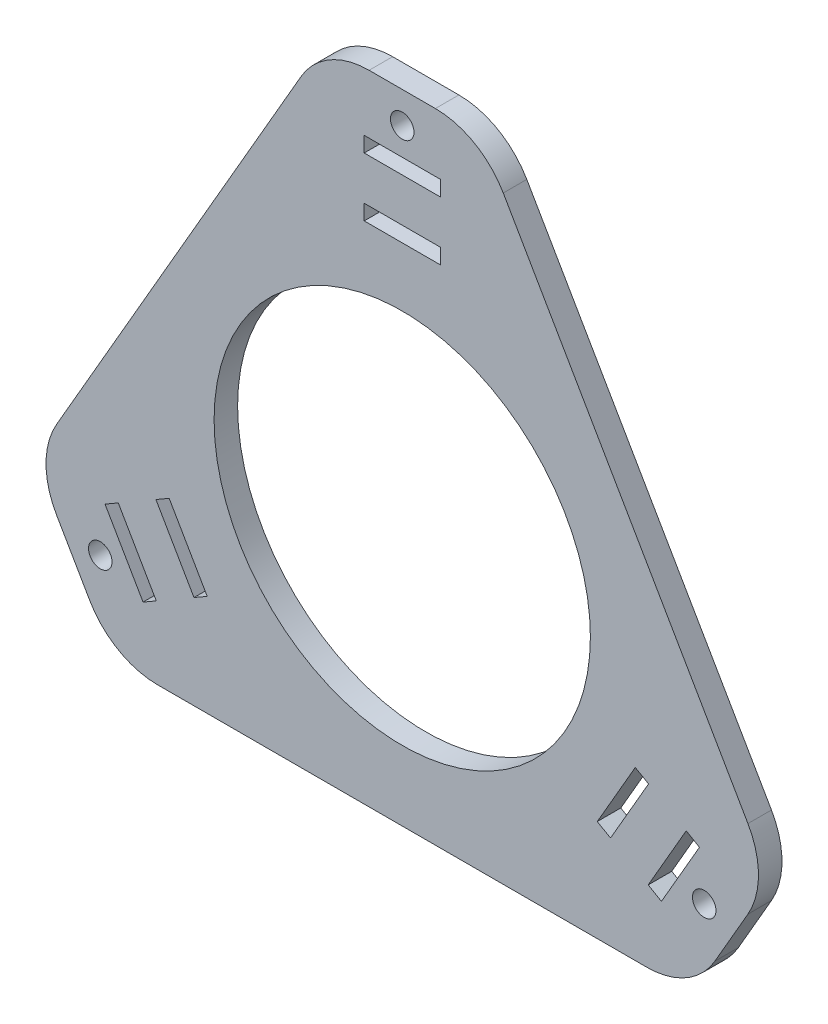
from build123d import *

# Parameters (mm, degrees)
SKETCH_1_R      = 1.5
SKETCH_1_R_2    = 24
SKETCH_1_W      = 9.7
SKETCH_1_H      = 1.95
EXTRUDE_4_DEPTH = 3


with BuildPart() as part:
    # Эскиз1 → Бобышка-Вытянуть4 (new body)
    with BuildSketch(Plane.XY):
        with BuildLine():
            Line((-31.207078757, -32.897754038), (31.207078757, -32.897754038))
            ThreePointArc((31.207078757, -32.897754038), (36.207078757, -31.558008076), (39.867332794, -27.897754038))
            Line((39.867332794, -27.897754038), (44.093830103, -20.577245962))
            ThreePointArc((44.093830103, -20.577245962), (45.433576065, -15.577245962), (44.093830103, -10.577245962))
            Line((44.093830103, -10.577245962), (12.886751346, 43.475))
            ThreePointArc((12.886751346, 43.475), (9.226497308, 47.135254038), (4.226497308, 48.475))
            Line((4.226497308, 48.475), (-4.226497308, 48.475))
            ThreePointArc((-4.226497308, 48.475), (-9.226497308, 47.135254038), (-12.886751346, 43.475))
            Line((-12.886751346, 43.475), (-44.093830103, -10.577245962))
            ThreePointArc((-44.093830103, -10.577245962), (-45.433576065, -15.577245962), (-44.093830103, -20.577245962))
            Line((-44.093830103, -20.577245962), (-39.867332794, -27.897754038))
            ThreePointArc((-39.867332794, -27.897754038), (-36.207078757, -31.558008076), (-31.207078757, -32.897754038))
        make_face()
        with Locations((-38.516479833, -22.2375)):
            Circle(SKETCH_1_R, mode=Mode.SUBTRACT)
        with Locations(Location((0, 44.475, 0), (0, 0, 180))):
            Circle(SKETCH_1_R, mode=Mode.SUBTRACT)
        with Locations((38.516479833, -22.2375)):
            Circle(SKETCH_1_R, mode=Mode.SUBTRACT)
        Circle(SKETCH_1_R_2, mode=Mode.SUBTRACT)
        Polygon((-33.06039092, -24.687723208), (-37.91039092, -16.287276792), (-36.221641383, -15.312276792), (-31.371641383, -23.712723208), align=None, mode=Mode.SUBTRACT)
        with Locations((0, 40)):
            Rectangle(SKETCH_1_W, SKETCH_1_H, mode=Mode.SUBTRACT)
        Polygon((37.91039092, -16.287276792), (33.06039092, -24.687723208), (31.371641383, -23.712723208), (36.221641383, -15.312276792), align=None, mode=Mode.SUBTRACT)
        Polygon((-26.565200392, -20.937723208), (-31.415200392, -12.537276792), (-29.726450854, -11.562276792), (-24.876450854, -19.962723208), align=None, mode=Mode.SUBTRACT)
        with Locations((0, 32.5)):
            Rectangle(SKETCH_1_W, SKETCH_1_H, mode=Mode.SUBTRACT)
        Polygon((31.415200392, -12.537276792), (26.565200392, -20.937723208), (24.876450854, -19.962723208), (29.726450854, -11.562276792), align=None, mode=Mode.SUBTRACT)
    extrude(amount=EXTRUDE_4_DEPTH)


solid = part.part
